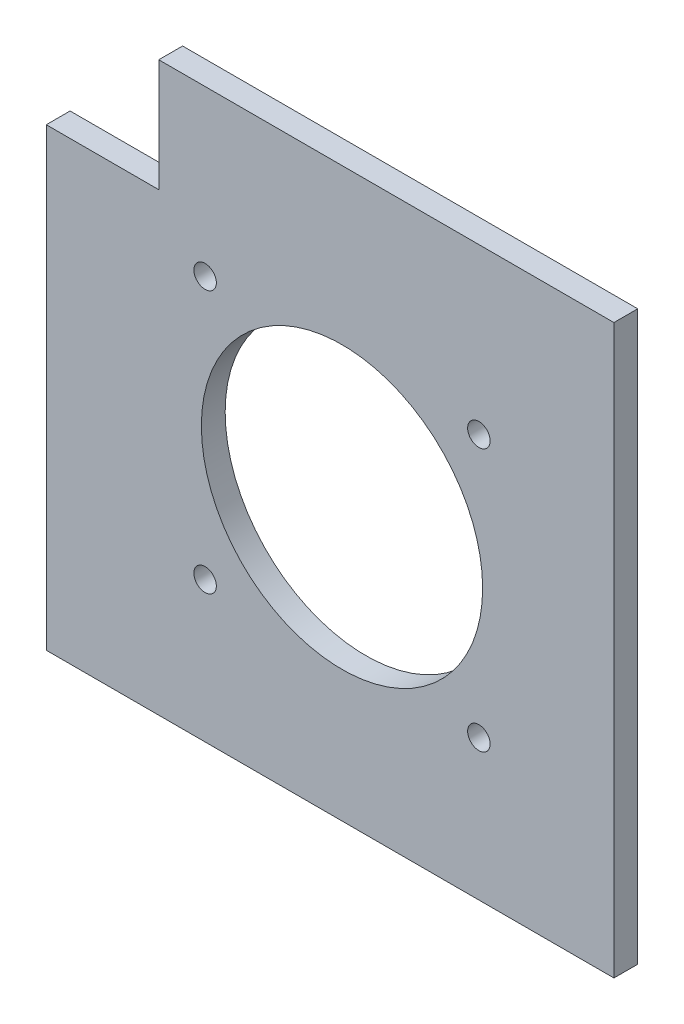
from build123d import *

# Parameters (mm, degrees)
SALIENTE_EXTRUIR1_DEPTH = 6.35
CROQUIS2_R              = 37.5
CROQUIS2_R_2            = 3
CORTAR_EXTRUIR1_DEPTH   = 6.35


with BuildPart() as part:
    # Croquis1 → Saliente-Extruir1 (new body)
    with BuildSketch(Plane.XY):
        Polygon((-50.356515977, -4.516705607), (-50.356515977, -125.866705607), (100.993484023, -125.866705607), (100.993484023, 25.483294393), (-20.356515977, 25.483294393), (-20.356515977, -4.516705607), align=None)
    extrude(amount=SALIENTE_EXTRUIR1_DEPTH)

    # Croquis2 → Cortar-Extruir1 (cut)
    with BuildSketch(Plane.XY.offset(6.35)):
        with Locations((28.493484023, -53.366705607)):
            Circle(CROQUIS2_R)
        with Locations((-8.006515977, -18.366705607)):
            Circle(CROQUIS2_R_2)
        with Locations((-8.006515977, -88.366705607)):
            Circle(CROQUIS2_R_2)
        with Locations(Location((64.993484023, -18.366705607, 0), (0, 0, 180))):
            Circle(CROQUIS2_R_2)
        with Locations(Location((64.993484023, -88.366705607, 0), (0, 0, 180))):
            Circle(CROQUIS2_R_2)
    extrude(amount=-CORTAR_EXTRUIR1_DEPTH, mode=Mode.SUBTRACT)


solid = part.part
